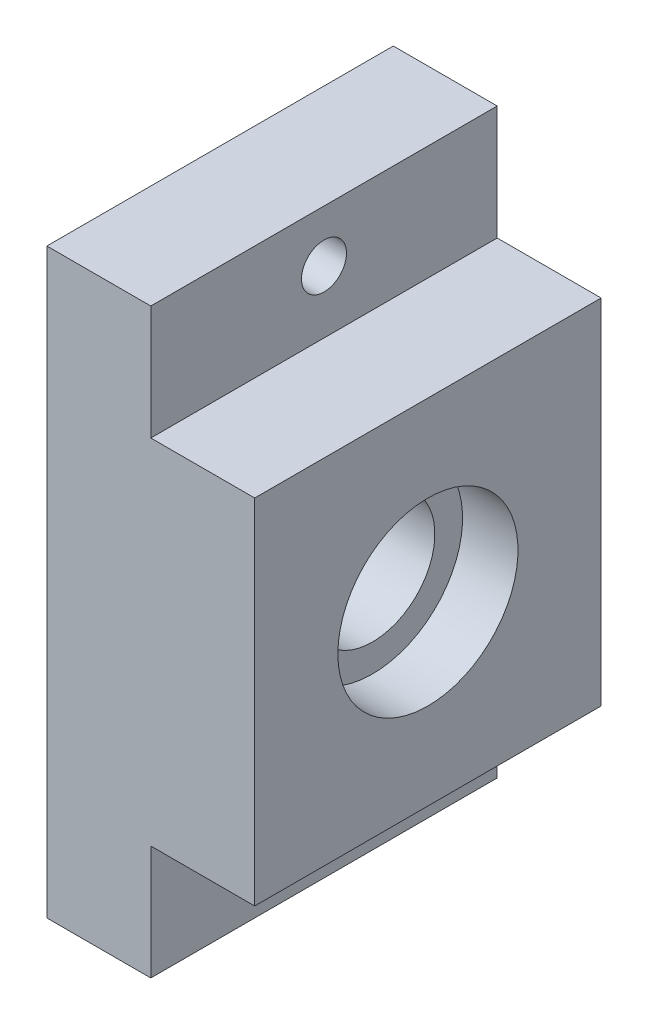
from build123d import *

# Parameters (mm, degrees)
BOSS_EXTRUDE1_DEPTH        = 50
F_6_5_6_5_DIAMETER_HOLE1_D = 6.5


with BuildPart() as part:
    # Sketch1 → Boss-Extrude1 (new body)
    with BuildSketch(Plane.XY):
        Polygon((0, 42), (0, -42), (15, -42), (15, -25.5), (30, -25.5), (30, 25.5), (15, 25.5), (15, 42), align=None)
    extrude(amount=BOSS_EXTRUDE1_DEPTH)

    # Ø6.5 (6.5) Diameter Hole1 (through all)
    with Locations(Plane(origin=(15, 0, 0), x_dir=(0, 0, -1), z_dir=(1, 0, 0))):
        with Locations((-25, -34.5), (-25, 34.5)):
            Hole(F_6_5_6_5_DIAMETER_HOLE1_D / 2)

    # Sketch4 → Cut-Revolve1 (revolve, cut)
    with BuildSketch(Plane(origin=(0, 0, 0), x_dir=(1, 0, 0), z_dir=(0, 1, 0))):
        Polygon((0, -25), (0, -38), (8, -38), (8, -34), (22, -34), (22, -38), (30, -38), (30, -25), align=None)
    revolve(axis=Axis((0, 0, 25), (1, 0, 0)), mode=Mode.SUBTRACT)


solid = part.part
